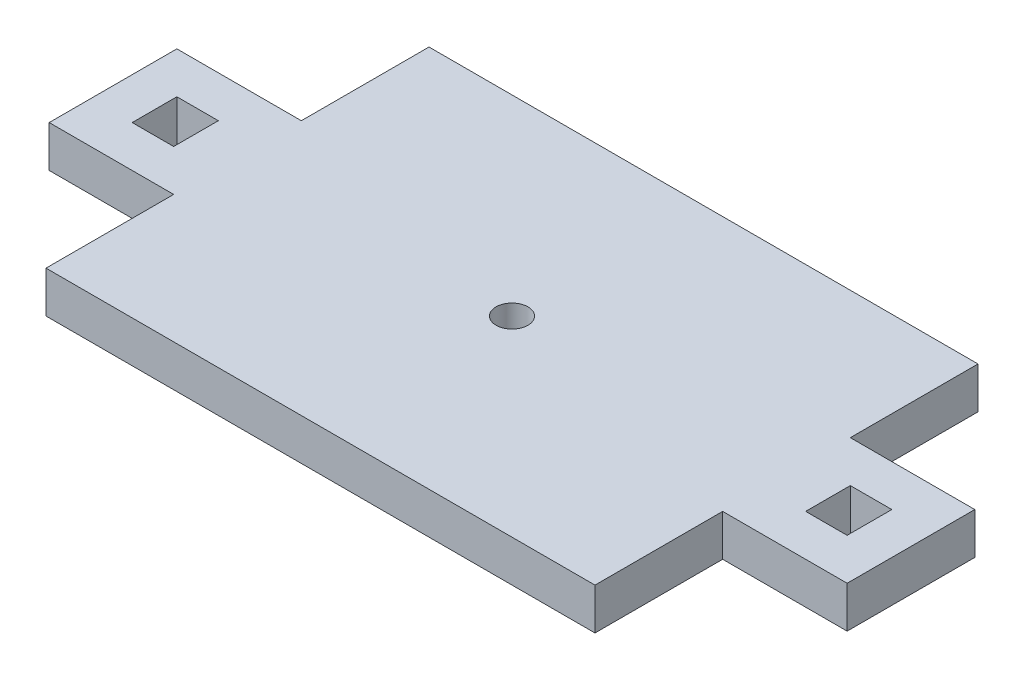
from build123d import *

# Parameters (mm, degrees)
SKETCH1_W           = 125
SKETCH1_H           = 60
BOSS_EXTRUDE1_DEPTH = 6.5
CUT_EXTRUDE1_REACH  = 140.807
SKETCH2_W           = 19.5
SKETCH2_H           = 20
CUT_EXTRUDE2_REACH  = 140.807
SKETCH3_R           = 2.5
CUT_EXTRUDE3_REACH  = 140.807
SKETCH6_W           = 6.5
SKETCH6_H           = 7


with BuildPart() as part:
    # Sketch1 → Boss-Extrude1 (new body)
    with BuildSketch(Plane(origin=(0, 0, 0), x_dir=(1, 0, 0), z_dir=(0, 1, 0))):
        with Locations((62.5, 30)):
            Rectangle(SKETCH1_W, SKETCH1_H)
    extrude(amount=BOSS_EXTRUDE1_DEPTH)

    # Sketch2 → Cut-Extrude1 (cut, up to next)
    with BuildSketch(Plane(origin=(0, 6.5, 0), x_dir=(1, 0, 0), z_dir=(0, 1, 0)), mode=Mode.PRIVATE) as cut_extrude1_sk1:
        with Locations((9.75, 50)):
            Rectangle(SKETCH2_W, SKETCH2_H)
    cut_extrude1_tool1 = extrude(cut_extrude1_sk1.sketch, amount=-CUT_EXTRUDE1_REACH, mode=Mode.PRIVATE) & part.part
    # Sketch2 → Cut-Extrude1 (cut, up to next)
    with BuildSketch(Plane(origin=(0, 6.5, 0), x_dir=(1, 0, 0), z_dir=(0, 1, 0)), mode=Mode.PRIVATE) as cut_extrude1_sk2:
        with Locations((9.75, 10)):
            Rectangle(SKETCH2_W, SKETCH2_H)
    cut_extrude1_tool2 = extrude(cut_extrude1_sk2.sketch, amount=-CUT_EXTRUDE1_REACH, mode=Mode.PRIVATE) & part.part
    # Sketch2 → Cut-Extrude1 (cut, up to next)
    with BuildSketch(Plane(origin=(0, 6.5, 0), x_dir=(1, 0, 0), z_dir=(0, 1, 0)), mode=Mode.PRIVATE) as cut_extrude1_sk3:
        with Locations((115.25, 50)):
            Rectangle(SKETCH2_W, SKETCH2_H)
    cut_extrude1_tool3 = extrude(cut_extrude1_sk3.sketch, amount=-CUT_EXTRUDE1_REACH, mode=Mode.PRIVATE) & part.part
    # Sketch2 → Cut-Extrude1 (cut, up to next)
    with BuildSketch(Plane(origin=(0, 6.5, 0), x_dir=(1, 0, 0), z_dir=(0, 1, 0)), mode=Mode.PRIVATE) as cut_extrude1_sk4:
        with Locations((115.25, 10)):
            Rectangle(SKETCH2_W, SKETCH2_H)
    cut_extrude1_tool4 = extrude(cut_extrude1_sk4.sketch, amount=-CUT_EXTRUDE1_REACH, mode=Mode.PRIVATE) & part.part
    add(cut_extrude1_tool1.solids().sort_by_distance((9.75, 6.5, -50))[0], mode=Mode.SUBTRACT)
    add(cut_extrude1_tool2.solids().sort_by_distance((9.75, 6.5, -10))[0], mode=Mode.SUBTRACT)
    add(cut_extrude1_tool3.solids().sort_by_distance((115.25, 6.5, -50))[0], mode=Mode.SUBTRACT)
    add(cut_extrude1_tool4.solids().sort_by_distance((115.25, 6.5, -10))[0], mode=Mode.SUBTRACT)

    # Sketch3 → Cut-Extrude2 (cut, up to next)
    with BuildSketch(Plane(origin=(0, 6.5, 0), x_dir=(1, 0, 0), z_dir=(0, 1, 0)), mode=Mode.PRIVATE) as cut_extrude2_sk1:
        with Locations(Location((62.5, 30, 0), (0, 0, 270))):
            Circle(SKETCH3_R)
    cut_extrude2_tool1 = extrude(cut_extrude2_sk1.sketch, amount=-CUT_EXTRUDE2_REACH, mode=Mode.PRIVATE) & part.part
    add(cut_extrude2_tool1.solids().sort_by_distance((62.5, 6.5, -30))[0], mode=Mode.SUBTRACT)

    # Sketch6 → Cut-Extrude3 (cut, up to next)
    with BuildSketch(Plane(origin=(0, 6.5, 0), x_dir=(1, 0, 0), z_dir=(0, 1, 0)), mode=Mode.PRIVATE) as cut_extrude3_sk1:
        with Locations((9.75, 30)):
            Rectangle(SKETCH6_W, SKETCH6_H)
    cut_extrude3_tool1 = extrude(cut_extrude3_sk1.sketch, amount=-CUT_EXTRUDE3_REACH, mode=Mode.PRIVATE) & part.part
    # Sketch6 → Cut-Extrude3 (cut, up to next)
    with BuildSketch(Plane(origin=(0, 6.5, 0), x_dir=(1, 0, 0), z_dir=(0, 1, 0)), mode=Mode.PRIVATE) as cut_extrude3_sk2:
        with Locations((115.25, 30)):
            Rectangle(SKETCH6_W, SKETCH6_H)
    cut_extrude3_tool2 = extrude(cut_extrude3_sk2.sketch, amount=-CUT_EXTRUDE3_REACH, mode=Mode.PRIVATE) & part.part
    add(cut_extrude3_tool1.solids().sort_by_distance((9.75, 6.5, -30))[0], mode=Mode.SUBTRACT)
    add(cut_extrude3_tool2.solids().sort_by_distance((115.25, 6.5, -30))[0], mode=Mode.SUBTRACT)


solid = part.part
